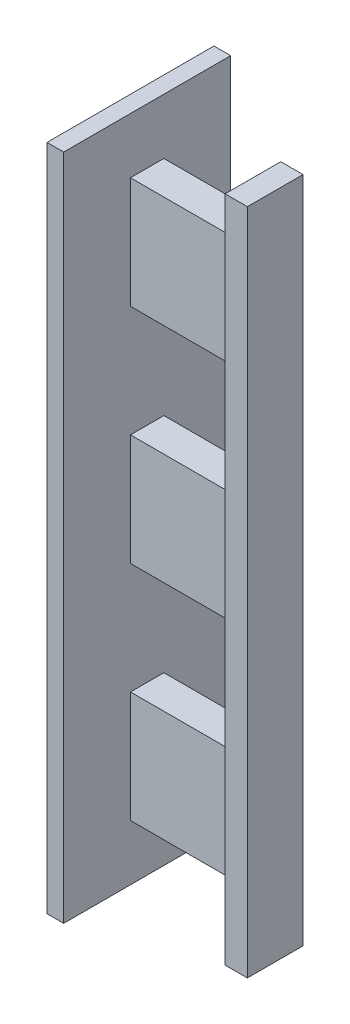
from build123d import *

# Parameters (mm, degrees)
SKETCH_1_W      = 5
SKETCH_1_H      = 60
EXTRUDE_1_DEPTH = 2
SKETCH_2_W      = 3
SKETCH_2_H      = 10
EXTRUDE_2_DEPTH = 10.5
SKETCH_3_W      = 15
SKETCH_3_H      = 60
EXTRUDE_3_DEPTH = 1.5


with BuildPart() as part:
    # 草图1 → 凸台-拉伸1 (new body)
    with BuildSketch(Plane(origin=(0, 0, 0), x_dir=(0, 0, -1), z_dir=(1, 0, 0))):
        with Locations((-1, 0)):
            Rectangle(SKETCH_1_W, SKETCH_1_H)
    extrude(amount=EXTRUDE_1_DEPTH)

    # 草图2 → 凸台-拉伸2 (add)
    with BuildSketch(Plane.ZY):
        with Locations((0, 20)):
            Rectangle(SKETCH_2_W, SKETCH_2_H)
        Rectangle(SKETCH_2_W, SKETCH_2_H)
        with Locations((0, -20)):
            Rectangle(SKETCH_2_W, SKETCH_2_H)
    extrude(amount=EXTRUDE_2_DEPTH)

    # 草图3 → 凸台-拉伸3 (add)
    with BuildSketch(Plane.ZY.offset(10.5)):
        Rectangle(SKETCH_3_W, SKETCH_3_H)
    extrude(amount=EXTRUDE_3_DEPTH)


solid = part.part
